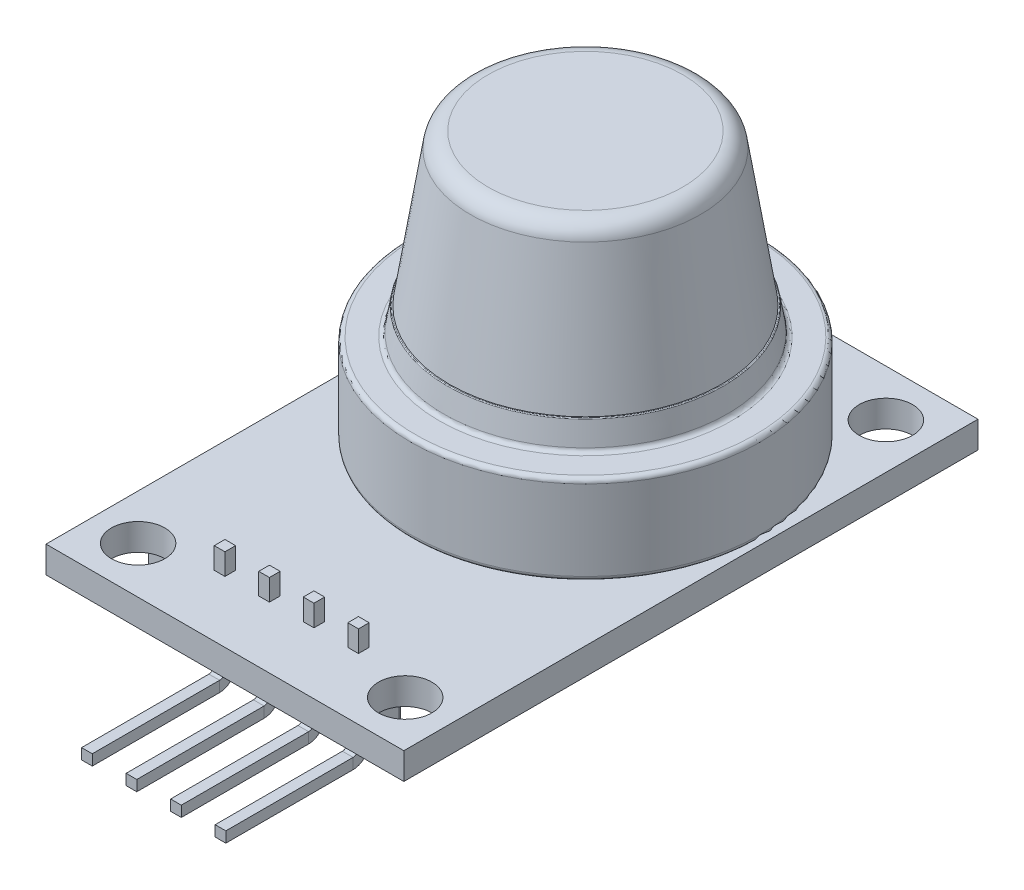
from build123d import *

# Parameters (mm, degrees)
SKETCH1_W                  = 20.1
SKETCH1_H                  = 32.25
SKETCH1_R                  = 1.5
BOSS_EXTRUDE1_DEPTH        = 1.5
SKETCH2_W                  = 0.6
SKETCH2_H                  = 0.6
BOSS_EXTRUDE2_DEPTH        = 2
SKETCH4_W                  = 0.6
SKETCH4_H                  = 0.6
CUT_EXTRUDE1_DEPTH         = 1.5
SKETCH5_W                  = 0.6
SKETCH5_H                  = 0.6
SKETCH6_W                  = 7
SKETCH6_H                  = 7
BOSS_EXTRUDE3_DEPTH        = 5
SKETCH7_W                  = 0.5
SKETCH7_H                  = 1
SKETCH7_H_2                = 0.5
CUT_EXTRUDE2_DEPTH         = 4.6
SKETCH8_R                  = 1.55
CUT_EXTRUDE3_DEPTH         = 0.25
CUT_EXTRUDE4_DEPTH         = 0.2
S_LIDO_MOVER_COPIAR1_ANGLE = 180


with BuildPart() as part:
    # Sketch1 → Boss-Extrude1 (new body)
    with BuildSketch(Plane(origin=(0, 0, 0), x_dir=(1, 0, 0), z_dir=(0, 1, 0))):
        with Locations((10.05, -16.125)):
            Rectangle(SKETCH1_W, SKETCH1_H)
        with Locations(Location((2.55, -2.625, 0), (0, 0, 270))):
            Circle(SKETCH1_R, mode=Mode.SUBTRACT)
        with Locations(Location((17.55, -2.625, 0), (0, 0, 270))):
            Circle(SKETCH1_R, mode=Mode.SUBTRACT)
        with Locations(Location((2.55, -29.625, 0), (0, 0, 270))):
            Circle(SKETCH1_R, mode=Mode.SUBTRACT)
        with Locations(Location((17.55, -29.625, 0), (0, 0, 270))):
            Circle(SKETCH1_R, mode=Mode.SUBTRACT)
    extrude(amount=BOSS_EXTRUDE1_DEPTH)

    # Sketch2 → Boss-Extrude2 (add)
    with BuildSketch(Plane(origin=(0, 1.5, 0), x_dir=(1, 0, 0), z_dir=(0, 1, 0))):
        with BuildLine():
            Line((5.3, -27.25), (7.3, -27.25))
            ThreePointArc((7.3, -27.25), (7.476776695, -27.323223305), (7.55, -27.5))
            ThreePointArc((7.55, -27.5), (7.623223305, -27.323223305), (7.8, -27.25))
            Line((7.8, -27.25), (9.8, -27.25))
            ThreePointArc((9.8, -27.25), (9.976776695, -27.323223305), (10.05, -27.5))
            ThreePointArc((10.05, -27.5), (10.123223305, -27.323223305), (10.3, -27.25))
            Line((10.3, -27.25), (12.3, -27.25))
            ThreePointArc((12.3, -27.25), (12.476776695, -27.323223305), (12.55, -27.5))
            ThreePointArc((12.55, -27.5), (12.623223305, -27.323223305), (12.8, -27.25))
            Line((12.8, -27.25), (14.8, -27.25))
            ThreePointArc((14.8, -27.25), (14.976776695, -27.323223305), (15.05, -27.5))
            Line((15.05, -27.5), (15.05, -29.5))
            ThreePointArc((15.05, -29.5), (14.976776695, -29.676776695), (14.8, -29.75))
            Line((14.8, -29.75), (12.8, -29.75))
            ThreePointArc((12.8, -29.75), (12.623223305, -29.676776695), (12.55, -29.5))
            ThreePointArc((12.55, -29.5), (12.476776695, -29.676776695), (12.3, -29.75))
            Line((12.3, -29.75), (10.3, -29.75))
            ThreePointArc((10.3, -29.75), (10.123223305, -29.676776695), (10.05, -29.5))
            ThreePointArc((10.05, -29.5), (9.976776695, -29.676776695), (9.8, -29.75))
            Line((9.8, -29.75), (7.8, -29.75))
            ThreePointArc((7.8, -29.75), (7.623223305, -29.676776695), (7.55, -29.5))
            ThreePointArc((7.55, -29.5), (7.476776695, -29.676776695), (7.3, -29.75))
            Line((7.3, -29.75), (5.3, -29.75))
            ThreePointArc((5.3, -29.75), (5.123223305, -29.676776695), (5.05, -29.5))
            Line((5.05, -29.5), (5.05, -27.5))
            ThreePointArc((5.05, -27.5), (5.123223305, -27.323223305), (5.3, -27.25))
        make_face()
        with Locations((6.3, -28.5)):
            Rectangle(SKETCH2_W, SKETCH2_H, mode=Mode.SUBTRACT)
        with Locations((8.8, -28.5)):
            Rectangle(SKETCH2_W, SKETCH2_H, mode=Mode.SUBTRACT)
        with Locations((11.3, -28.5)):
            Rectangle(SKETCH2_W, SKETCH2_H, mode=Mode.SUBTRACT)
        with Locations((13.8, -28.5)):
            Rectangle(SKETCH2_W, SKETCH2_H, mode=Mode.SUBTRACT)
    extrude(amount=BOSS_EXTRUDE2_DEPTH)

    # Sketch4 → Cut-Extrude1 (cut)
    with BuildSketch(Plane(origin=(0, 1.5, 0), x_dir=(1, 0, 0), z_dir=(0, 1, 0))):
        with Locations((8.8, -28.5)):
            Rectangle(SKETCH4_W, SKETCH4_H)
        with Locations((6.3, -28.5)):
            Rectangle(SKETCH4_W, SKETCH4_H)
        with Locations((11.3, -28.5)):
            Rectangle(SKETCH4_W, SKETCH4_H)
        with Locations((13.8, -28.5)):
            Rectangle(SKETCH4_W, SKETCH4_H)
    extrude(amount=-CUT_EXTRUDE1_DEPTH, mode=Mode.SUBTRACT)

    # Sweep1: sweep along a path in Sketch3
    with BuildLine(Plane.ZY.offset(-5.05)) as sweep1_path:
        Line((28.5, -1.2), (28.5, 4.6))
        ThreePointArc((28.5, 4.6), (28.675735931, 5.024264069), (29.1, 5.2))
        Line((29.1, 5.2), (36.25, 5.2))
    # Sketch5 → Sweep1 (sweep)
    with BuildSketch(Plane(origin=(0, -1.2, 0), x_dir=(-1, 0, 0), z_dir=(0, -1, 0))):
        with Locations((-6.3, -28.5)):
            Rectangle(SKETCH5_W, SKETCH5_H)
        with Locations((-8.8, -28.5)):
            Rectangle(SKETCH5_W, SKETCH5_H)
        with Locations((-11.3, -28.5)):
            Rectangle(SKETCH5_W, SKETCH5_H)
        with Locations((-13.8, -28.5)):
            Rectangle(SKETCH5_W, SKETCH5_H)
    sweep(path=sweep1_path.line)

    # Sketch11 → Revolve1 (revolve)
    with BuildSketch(Plane(origin=(0, 0, 12), x_dir=(-1, 0, 0), z_dir=(0, 0, -1)), mode=Mode.PRIVATE) as revolve1_sk:
        with BuildLine():
            Line((-10.05, 0), (-0.5, 0))
            ThreePointArc((-0.5, 0), (-0.323223305, -0.073223305), (-0.25, -0.25))
            Line((-0.25, -0.25), (-0.25, -4.75))
            ThreePointArc((-0.25, -4.75), (-0.323223305, -4.926776695), (-0.5, -5))
            Line((-0.5, -5), (-1.838218228, -5))
            ThreePointArc((-1.838218228, -5), (-1.999811952, -5.059245004), (-2.084816709, -5.208900253))
            Line((-2.084816709, -5.208900253), (-2.293036658, -6.458219949))
            ThreePointArc((-2.293036658, -6.458219949), (-2.31003761, -6.488150999), (-2.342356354, -6.5))
            Line((-2.342356354, -6.5), (-2.4, -6.5))
            Line((-2.4, -6.5), (-3.590576645, -14.153707006))
            ThreePointArc((-3.590576645, -14.153707006), (-3.928195999, -14.759508725), (-4.578693114, -15))
            Line((-4.578693114, -15), (-10.05, -15))
            Line((-10.05, -15), (-10.05, 0))
        make_face()
    revolve(revolve1_sk.sketch.rotate(Axis((10.05, -15, 12), (0, 1, 0)), 270), axis=Axis((10.05, -15, 12), (0, 1, 0)))


with BuildPart() as body_2:
    # Sketch6 → Boss-Extrude3 (new body)
    with BuildSketch(Plane(origin=(0, 1.5, 0), x_dir=(1, 0, 0), z_dir=(0, 1, 0))):
        with Locations((16.35, -23.25)):
            Rectangle(SKETCH6_W, SKETCH6_H)
    extrude(amount=BOSS_EXTRUDE3_DEPTH)

    # Sketch7 → Cut-Extrude2 (cut)
    with BuildSketch(Plane.XZ.offset(-1.5)):
        with Locations((19.85, 23.25)):
            Rectangle(SKETCH7_W, SKETCH7_H)
        with Locations((19.85, 26)):
            Rectangle(SKETCH7_W, SKETCH7_H_2)
        with Locations((19.85, 20.25)):
            Rectangle(SKETCH7_W, SKETCH7_H_2)
    extrude(amount=-CUT_EXTRUDE2_DEPTH, mode=Mode.SUBTRACT)

    # Sketch8 → Cut-Extrude3 (cut)
    with BuildSketch(Plane(origin=(0, 6.5, 0), x_dir=(1, 0, 0), z_dir=(0, 1, 0))):
        with Locations(Location((16.35, -23.25, 0), (0, 0, 270))):
            Circle(SKETCH8_R)
    extrude(amount=-CUT_EXTRUDE3_DEPTH, mode=Mode.SUBTRACT)

    # Sketch9 → Cut-Extrude4 (cut)
    with BuildSketch(Plane(origin=(0, 6.25, 0), x_dir=(1, 0, 0), z_dir=(0, 1, 0))):
        with BuildLine():
            Line((16.52061089, -21.787346857), (16.25248865, -23.102549884))
            Line((16.25248865, -23.102549884), (14.937285624, -22.834427645))
            ThreePointArc((14.937285624, -22.834427645), (14.907108416, -22.955846691), (14.887346857, -23.07938911))
            Line((14.887346857, -23.07938911), (16.202549884, -23.34751135))
            Line((16.202549884, -23.34751135), (15.934427645, -24.662714376))
            ThreePointArc((15.934427645, -24.662714376), (16.055846691, -24.692891584), (16.17938911, -24.712653143))
            Line((16.17938911, -24.712653143), (16.44751135, -23.397450116))
            Line((16.44751135, -23.397450116), (17.762714376, -23.665572355))
            ThreePointArc((17.762714376, -23.665572355), (17.792891584, -23.544153309), (17.812653143, -23.42061089))
            Line((17.812653143, -23.42061089), (16.497450116, -23.15248865))
            Line((16.497450116, -23.15248865), (16.765572355, -21.837285624))
            ThreePointArc((16.765572355, -21.837285624), (16.644153309, -21.807108416), (16.52061089, -21.787346857))
        make_face()
    extrude(amount=-CUT_EXTRUDE4_DEPTH, mode=Mode.SUBTRACT)


with BuildPart() as part_1:
    # Sólido-Mover/Copiar1: moved
    add(part.part.rotate(Axis((13.2, -0.375, 0), (0, 0, 1)), S_LIDO_MOVER_COPIAR1_ANGLE))


with BuildPart() as body_2_1:
    # Sólido-Mover/Copiar1: moved
    add(body_2.part.rotate(Axis((13.2, -0.375, 0), (0, 0, 1)), S_LIDO_MOVER_COPIAR1_ANGLE))


solid = Compound([part_1.part, body_2_1.part])
